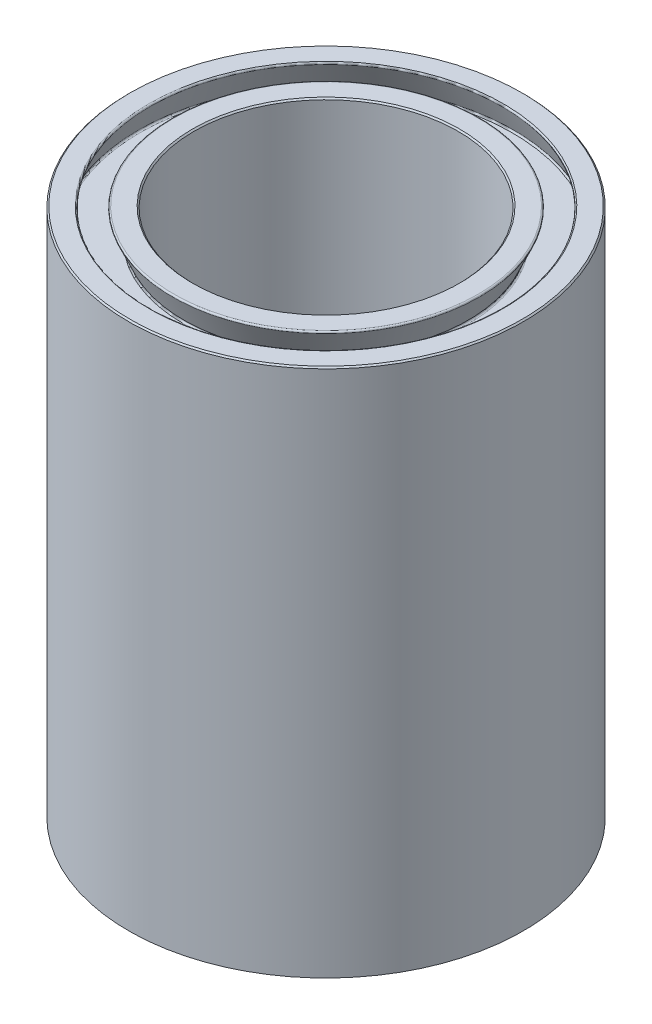
from build123d import *

# Parameters (mm, degrees)
FILLET1_R     = 0.396875
CHAMFER1_SIZE = 0.396875


with BuildPart() as part:
    # Sketch1 → Revolve1 (revolve)
    with BuildSketch(Plane.XY):
        with BuildLine():
            Line((0, 0), (-56.896, 0))
            Line((-56.896, 0), (-56.896, 152.4))
            Line((-56.896, 152.4), (-50.4825, 152.4))
            Line((-50.4825, 152.4), (-54.299222905, 143.8275))
            Line((-54.299222905, 143.8275), (-40.696777095, 143.8275))
            Line((-40.696777095, 143.8275), (-44.5135, 152.4))
            Line((-44.5135, 152.4), (-38.1, 152.4))
            Line((-38.1, 152.4), (-38.1, 34.925))
            ThreePointArc((-38.1, 34.925), (-30.660512242, 16.964487758), (-12.7, 9.525))
            Line((-12.7, 9.525), (0, 9.525))
            Line((0, 9.525), (0, 0))
        make_face()
    revolve(axis=Axis((0, 9.525, 0), (0, -1, 0)))

    # Fillet1
    fillet1_edges = [part.edges().sort_by_distance(p)[0] for p in [
        (50.4825, 152.4, 0),
        (54.299222905, 143.8275, 0),
        (40.696777095, 143.8275, 0),
        (44.5135, 152.4, 0),
    ]]
    fillet(fillet1_edges, radius=FILLET1_R)

    # Chamfer1
    chamfer1_edges = [part.edges().sort_by_distance(p)[0] for p in [
        (38.1, 152.4, 0),
        (56.896, 152.4, 0),
    ]]
    chamfer(chamfer1_edges, length=CHAMFER1_SIZE)


solid = part.part
